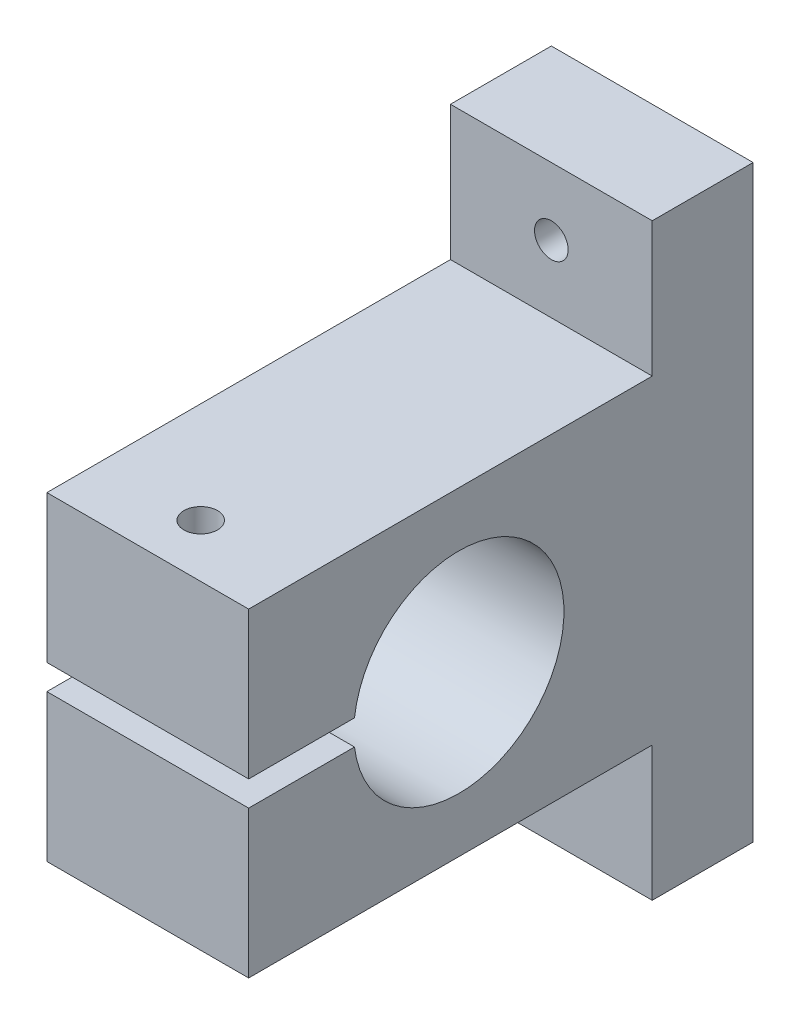
from build123d import *

# Parameters (mm, degrees)
BOSS_EXTRUDE1_DEPTH = 24
SKETCH2_R           = 2
CUT_EXTRUDE1_DEPTH  = 20
SKETCH3_R           = 2
CUT_EXTRUDE2_DEPTH  = 20.5


with BuildPart() as part:
    # Sketch1 → Boss-Extrude1 (new body)
    with BuildSketch(Plane(origin=(0, 0, 0), x_dir=(0, 0, -1), z_dir=(1, 0, 0))):
        with BuildLine():
            Line((23, 35), (23, 19))
            Line((23, 19), (-25, 19))
            Line((-25, 19), (-25, 1.5))
            Line((-25, 1.5), (-12.409673646, 1.5))
            ThreePointArc((-12.409673646, 1.5), (12.5, 0), (-12.409673646, -1.5))
            Line((-12.409673646, -1.5), (-25, -1.5))
            Line((-25, -1.5), (-25, -19))
            Line((-25, -19), (23, -19))
            Line((23, -19), (23, -35))
            Line((23, -35), (35, -35))
            Line((35, -35), (35, 35))
            Line((35, 35), (23, 35))
        make_face()
    extrude(amount=BOSS_EXTRUDE1_DEPTH)

    # Sketch2 → Cut-Extrude1 (cut)
    with BuildSketch(Plane.XY.offset(-23)):
        with Locations((12, -27)):
            Circle(SKETCH2_R)
    cut_extrude1 = extrude(amount=-CUT_EXTRUDE1_DEPTH, mode=Mode.SUBTRACT)

    # Sketch3 → Cut-Extrude2 (cut)
    with BuildSketch(Plane.XZ.offset(19)):
        with Locations(Location((12, 18.704836823, 0), (0, 0, 270))):
            Circle(SKETCH3_R)
    cut_extrude2 = extrude(amount=-CUT_EXTRUDE2_DEPTH, mode=Mode.SUBTRACT)

    # Mirror1: Cut-Extrude1, Cut-Extrude2 across plane
    add(cut_extrude1.mirror(Plane.ZX), mode=Mode.SUBTRACT)
    add(cut_extrude2.mirror(Plane.ZX), mode=Mode.SUBTRACT)


solid = part.part
